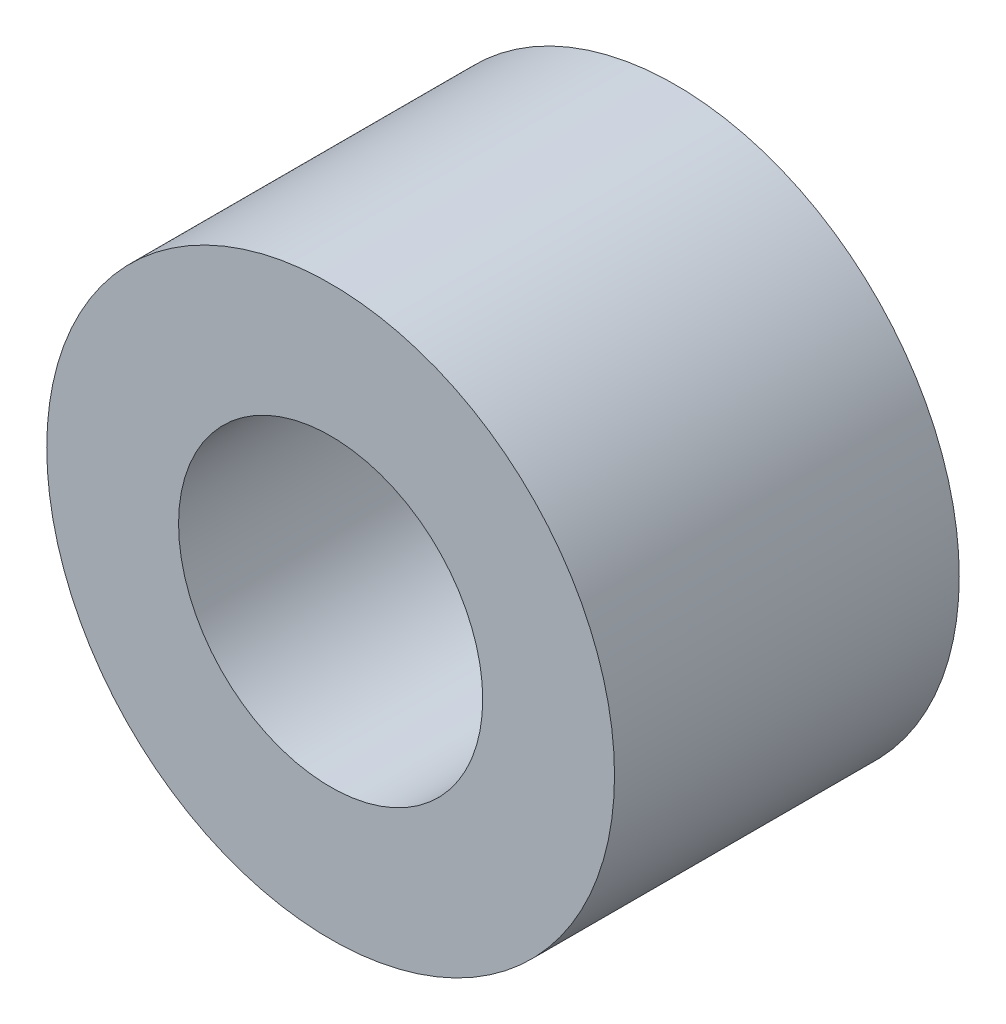
from build123d import *

# Parameters (mm, degrees)
SKETCH1_R           = 28
SKETCH1_R_2         = 15
BOSS_EXTRUDE1_DEPTH = 34
SKETCH2_R           = 1.5
CUT_EXTRUDE1_DEPTH  = 4
CIRPATTERN1_COUNT   = 2


with BuildPart() as part:
    # Sketch1 → Boss-Extrude1 (new body)
    with BuildSketch(Plane.XY):
        Circle(SKETCH1_R)
        Circle(SKETCH1_R_2, mode=Mode.SUBTRACT)
    extrude(amount=-BOSS_EXTRUDE1_DEPTH)

    # Sketch2 → Cut-Extrude1 (cut)
    with BuildSketch(Plane(origin=(0, 0, -34), x_dir=(-1, 0, 0), z_dir=(0, 0, -1))):
        with Locations((3, 23)):
            Circle(SKETCH2_R)
        with Locations((-3, 23)):
            Circle(SKETCH2_R)
    cut_extrude1 = extrude(amount=-CUT_EXTRUDE1_DEPTH, mode=Mode.SUBTRACT)

    # CirPattern1: Cut-Extrude1 ×2 about axis
    cirpattern1_axis = Axis((0, 0, -34), (0, 0, 1))
    for i in range(1, CIRPATTERN1_COUNT):
        add(cut_extrude1.rotate(cirpattern1_axis, i * 360 / CIRPATTERN1_COUNT), mode=Mode.SUBTRACT)


solid = part.part
